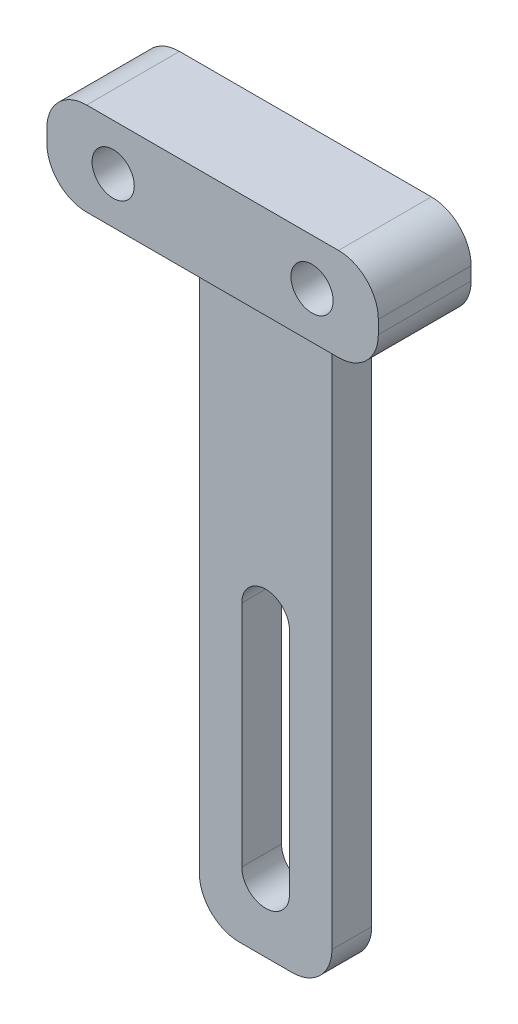
from build123d import *

# Parameters (mm, degrees)
BOSS_EXTRUDE1_DEPTH = 3
SKETCH3_W           = 25
SKETCH3_H           = 7
BOSS_EXTRUDE2_DEPTH = 4
SKETCH2_R           = 1.592288308
CUT_EXTRUDE1_DEPTH  = 10
FILLET1_R           = 3


with BuildPart() as part:
    # Sketch1 → Boss-Extrude1 (new body)
    with BuildSketch(Plane.XY):
        Polygon((-12.549665985, 17.237823834), (-5.049665985, 17.237823834), (-5.049665985, 24.237823834), (-30.049665985, 24.237823834), (-30.049665985, 17.237823834), (-22.549665985, 17.237823834), (-22.549665985, -28.68448974), (-12.549665985, -28.68448974), align=None)
        with BuildLine():
            Line((-19.349665985, -23.68448974), (-19.349665985, -6.438362401))
            ThreePointArc((-19.349665985, -6.438362401), (-17.549665985, -4.638362401), (-15.749665985, -6.438362401))
            Line((-15.749665985, -6.438362401), (-15.749665985, -23.68448974))
            ThreePointArc((-15.749665985, -23.68448974), (-17.549665985, -25.48448974), (-19.349665985, -23.68448974))
        make_face(mode=Mode.SUBTRACT)
    extrude(amount=BOSS_EXTRUDE1_DEPTH)

    # Sketch3 → Boss-Extrude2 (add)
    with BuildSketch(Plane.XY.offset(3)):
        with Locations((-17.549665985, 20.737823834)):
            Rectangle(SKETCH3_W, SKETCH3_H)
    extrude(amount=BOSS_EXTRUDE2_DEPTH)

    # Sketch2 → Cut-Extrude1 (cut)
    with BuildSketch(Plane.XY):
        with Locations((-25.049665985, 20.737823834)):
            Circle(SKETCH2_R)
        with Locations((-10.049665985, 20.737823834)):
            Circle(SKETCH2_R)
    extrude(amount=CUT_EXTRUDE1_DEPTH, mode=Mode.SUBTRACT)

    # Fillet1
    fillet1_edges = [part.edges().sort_by_distance(p)[0] for p in [
        (-5.049665985, 17.237823834, 3.5),
        (-12.549665985, 17.237823834, 1.5),
        (-12.549665985, -28.68448974, 1.5),
        (-22.549665985, -28.68448974, 1.5),
        (-22.549665985, 17.237823834, 1.5),
        (-30.049665985, 17.237823834, 3.5),
        (-30.049665985, 24.237823834, 3.5),
        (-5.049665985, 24.237823834, 3.5),
        (-17.549665985, 17.237823834, 3),
    ]]
    fillet(fillet1_edges, radius=FILLET1_R)


solid = part.part
